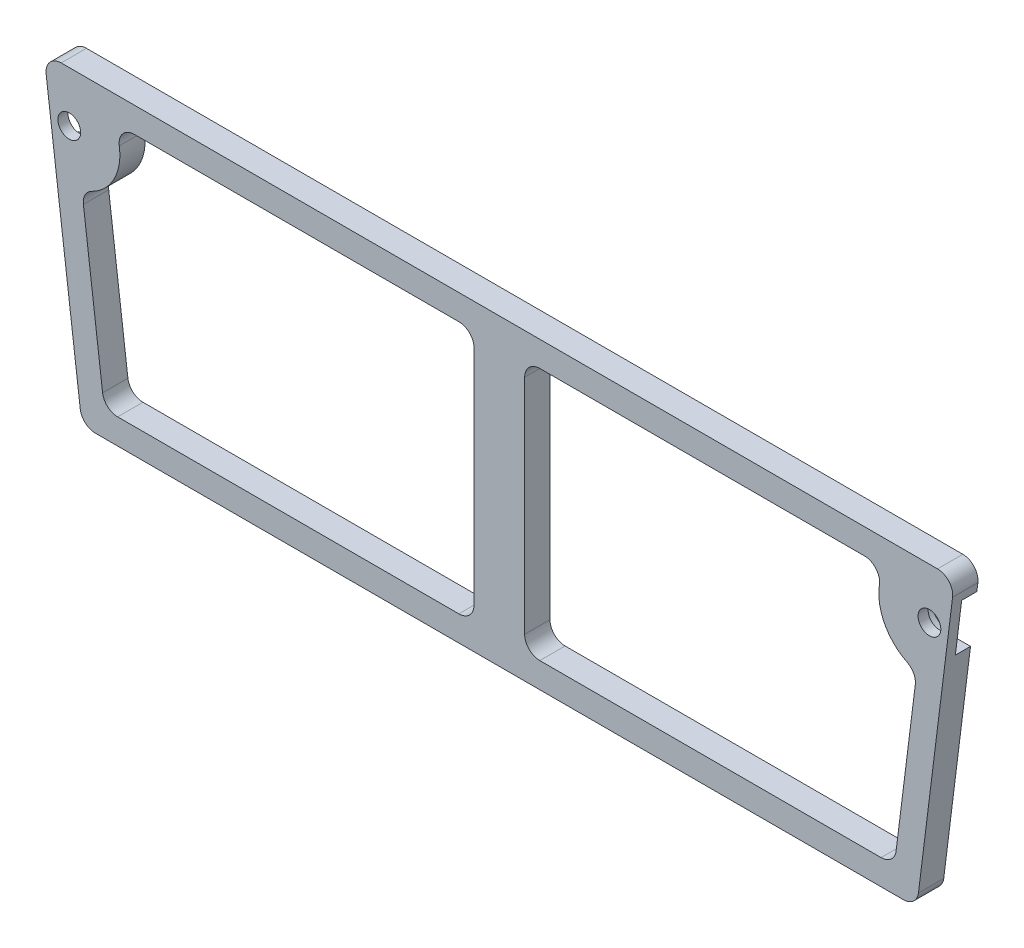
from build123d import *

# Parameters (mm, degrees)
SZKIC1_R                    = 2.25
DODANIE_WYCI_GNI_CIE1_DEPTH = 5
WYTNIJ_WYCI_GNI_CIE1_DEPTH  = 3
ZAOKR_GLENIE3_R             = 3
WYTNIJ_WYCI_GNI_CIE3_DEPTH  = 108.951175455
ZAOKR_GLENIE4_R             = 3


with BuildPart() as part:
    # Szkic1 → Dodanie-wyciągnięcie1 (new body)
    with BuildSketch(Plane.XY):
        Polygon((0, 0), (-90, 0), (-82.5, -60), (0, -60), align=None)
        with Locations((-85, -10)):
            Circle(SZKIC1_R, mode=Mode.SUBTRACT)
    extrude(amount=DODANIE_WYCI_GNI_CIE1_DEPTH)

    # Szkic1<3> → Wytnij-wyciągnięcie1 (cut)
    with BuildSketch(Plane.XY):
        with BuildLine():
            Line((-85, -5), (-89.375, -5))
            Line((-89.375, -5), (-89.106551139, -7.147590888))
            ThreePointArc((-89.106551139, -7.147590888), (-89.961389384, -10.620173673), (-88.278064246, -13.775486035))
            Line((-88.278064246, -13.775486035), (-88.125, -15))
            Line((-88.125, -15), (-85, -15))
            ThreePointArc((-85, -15), (-80, -10), (-85, -5))
        make_face()
    extrude(amount=WYTNIJ_WYCI_GNI_CIE1_DEPTH, mode=Mode.SUBTRACT)

    # Zaokrąglenie3
    zaokr_glenie3_edges = [part.edges().sort_by_distance(p)[0] for p in [
        (-82.5, -60, 2.5),
        (-90, 0, 2.5),
    ]]
    fillet(zaokr_glenie3_edges, radius=ZAOKR_GLENIE3_R)

    # Szkic5 → Wytnij-wyciągnięcie3 (cut, through all)
    with BuildSketch(Plane(origin=(0, 0, 0), x_dir=(-1, 0, 0), z_dir=(0, 0, -1))):
        with BuildLine():
            Line((5, -55), (78.086088907, -55))
            Line((78.086088907, -55), (82.500757178, -19.682653836))
            ThreePointArc((82.500757178, -19.682653836), (75.778900637, -13.869279847), (76.339745962, -5))
            Line((76.339745962, -5), (5, -5))
            Line((5, -5), (5, -55))
        make_face()
    extrude(amount=-WYTNIJ_WYCI_GNI_CIE3_DEPTH, mode=Mode.SUBTRACT)

    # Zaokrąglenie4
    zaokr_glenie4_edges = [part.edges().sort_by_distance(p)[0] for p in [
        (-5, -5, 2.5),
        (-5, -55, 2.5),
        (-78.086088907, -55, 2.5),
        (-82.500757178, -19.682653836, 2.5),
        (-76.339745962, -5, 2.5),
    ]]
    fillet(zaokr_glenie4_edges, radius=ZAOKR_GLENIE4_R)

    # Lustro5: part across plane


with BuildPart() as part_1:
    add(part.part)
    add(part.part.mirror(Plane(origin=(0, 0, 0), x_dir=(0, 0, 1), z_dir=(1, 0, 0))))


solid = part_1.part
